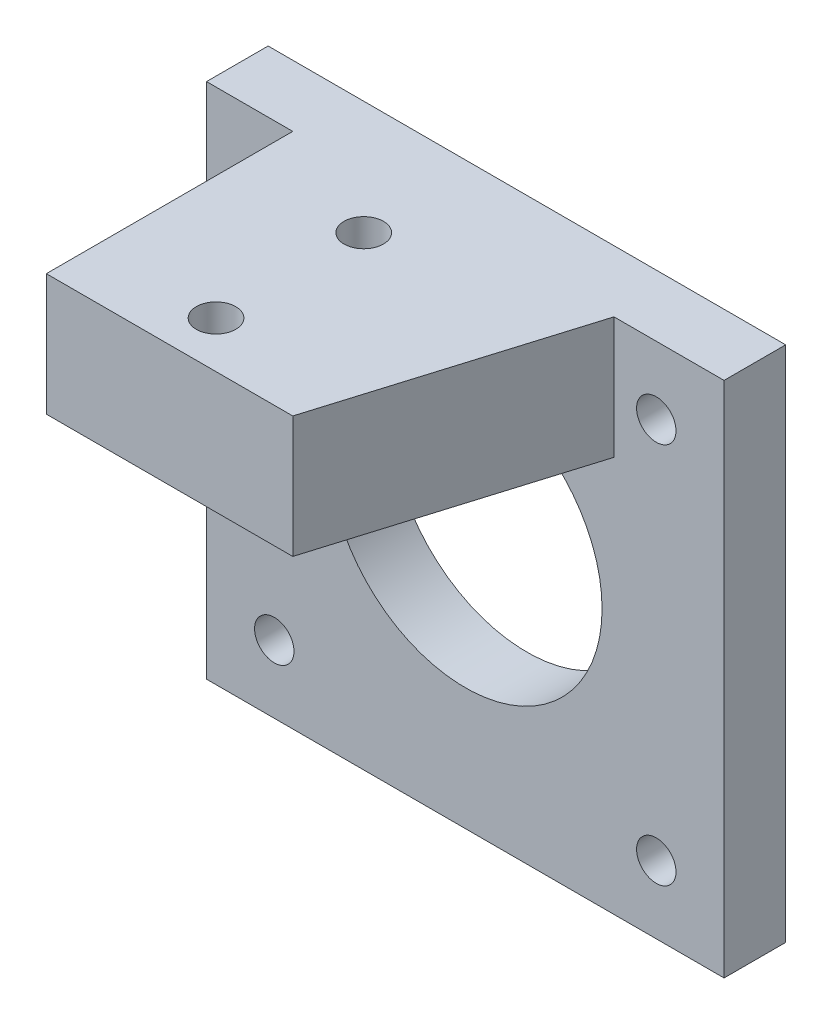
from build123d import *

# Parameters (mm, degrees)
SKETCH_1_W          = 42
SKETCH_1_H          = 42
SKETCH_1_R          = 11.1
EXTRUDE_1_DEPTH     = 5
SKETCH_2_R          = 1.6
CUT_EXTRUDE_1_DEPTH = 60.607046563
SKETCH_4_W          = 20
SKETCH_4_H          = 9.874323587
EXTRUDE_2_DEPTH     = 20
SKETCH_5_R          = 1.6
CUT_EXTRUDE_2_DEPTH = 20
SKETCH_6_R          = 3
CUT_EXTRUDE_3_DEPTH = 3
EXTRUDE_3_DEPTH     = 9.874324


with BuildPart() as part:
    # 草图1 → 凸台-拉伸1 (new body)
    with BuildSketch(Plane.XY):
        with Locations((21, 21)):
            Rectangle(SKETCH_1_W, SKETCH_1_H)
        with Locations((21, 21)):
            Circle(SKETCH_1_R, mode=Mode.SUBTRACT)
    extrude(amount=EXTRUDE_1_DEPTH)

    # 草图2 → 切除-拉伸1 (cut, through all)
    with BuildSketch(Plane.XY.offset(5)):
        with Locations(Location((36.5, 36.5, 0), (0, 0, 180))):
            Circle(SKETCH_2_R)
        with Locations((5.5, 36.5)):
            Circle(SKETCH_2_R)
        with Locations((36.5, 5.5)):
            Circle(SKETCH_2_R)
        with Locations(Location((5.5, 5.5, 0), (0, 0, 180))):
            Circle(SKETCH_2_R)
    extrude(amount=-CUT_EXTRUDE_1_DEPTH, mode=Mode.SUBTRACT)

    # 草图4 → 凸台-拉伸2 (add)
    with BuildSketch(Plane.XY.offset(5)):
        with Locations((17, 37.062838207)):
            Rectangle(SKETCH_4_W, SKETCH_4_H)
    extrude(amount=EXTRUDE_2_DEPTH)

    # 草图5 → 切除-拉伸2 (cut)
    with BuildSketch(Plane.XZ.offset(-32.125676413)):
        with Locations(Location((17, 21.228996284, 0), (0, 0, 270))):
            Circle(SKETCH_5_R)
        with Locations(Location((17, 9.241211578, 0), (0, 0, 270))):
            Circle(SKETCH_5_R)
    extrude(amount=-CUT_EXTRUDE_2_DEPTH, mode=Mode.SUBTRACT)

    # 草图6 → 切除-拉伸3 (cut)
    with BuildSketch(Plane.XZ.offset(-32.125676413)):
        with Locations(Location((17, 21.228996284, 0), (0, 0, 270))):
            Circle(SKETCH_6_R)
        with Locations(Location((17, 9.241211578, 0), (0, 0, 270))):
            Circle(SKETCH_6_R)
    extrude(amount=-CUT_EXTRUDE_3_DEPTH, mode=Mode.SUBTRACT)

    # 草图7 → 凸台-拉伸3 (add)
    with BuildSketch(Plane.XZ.offset(-32.125676413)):
        Polygon((27, 5), (33.066312707, 5), (27, 25), align=None)
    extrude(amount=-EXTRUDE_3_DEPTH)


solid = part.part
